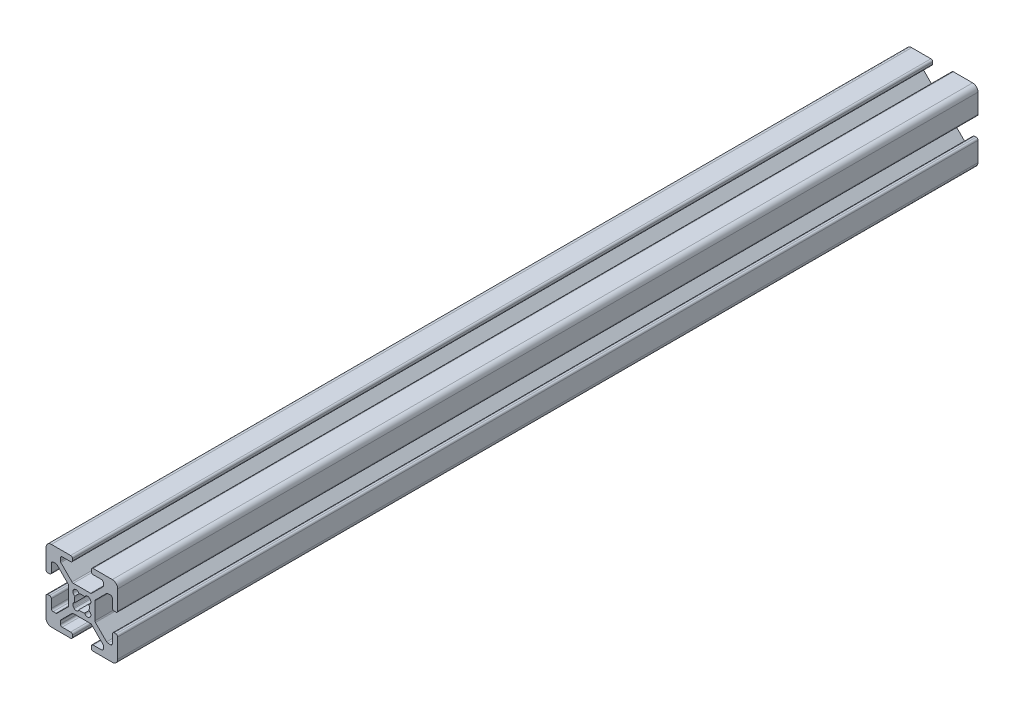
from build123d import *

# Parameters (mm, degrees)
BOSS_EXTRUDE1_DEPTH = 120


with BuildPart() as part:
    # Sketch1 → Boss-Extrude1 (new, symmetric)
    with BuildSketch(Plane.XY):
        with BuildLine():
            Line((10, 3.138), (10, 8.5))
            ThreePointArc((10, 8.5), (9.560660172, 9.560660172), (8.5, 10))
            Line((8.5, 10), (3.138, 10))
            ThreePointArc((3.138, 10), (2.778789755, 9.851210245), (2.63, 9.492))
            Line((2.63, 9.492), (2.63, 9.008))
            ThreePointArc((2.63, 9.008), (2.778789755, 8.648789755), (3.138, 8.5))
            Line((3.138, 8.5), (5.487, 8.5))
            ThreePointArc((5.487, 8.5), (5.846210245, 8.351210245), (5.995, 7.992))
            Line((5.995, 7.992), (5.995, 7.266080661))
            ThreePointArc((5.995, 7.266080661), (5.956330803, 7.071677478), (5.846210245, 6.906870417))
            Line((5.846210245, 6.906870417), (2.743129583, 3.803789755))
            ThreePointArc((2.743129583, 3.803789755), (2.578322522, 3.693669197), (2.383919339, 3.655))
            Line((2.383919339, 3.655), (-2.383919339, 3.655))
            ThreePointArc((-2.383919339, 3.655), (-2.578322522, 3.693669197), (-2.743129583, 3.803789755))
            Line((-2.743129583, 3.803789755), (-5.846210245, 6.906870417))
            ThreePointArc((-5.846210245, 6.906870417), (-5.956330803, 7.071677478), (-5.995, 7.266080661))
            Line((-5.995, 7.266080661), (-5.995, 7.992))
            ThreePointArc((-5.995, 7.992), (-5.846210245, 8.351210245), (-5.487, 8.5))
            Line((-5.487, 8.5), (-3.138, 8.5))
            ThreePointArc((-3.138, 8.5), (-2.778789755, 8.648789755), (-2.63, 9.008))
            Line((-2.63, 9.008), (-2.63, 9.492))
            ThreePointArc((-2.63, 9.492), (-2.778789755, 9.851210245), (-3.138, 10))
            Line((-3.138, 10), (-8.5, 10))
            ThreePointArc((-8.5, 10), (-9.560660172, 9.560660172), (-10, 8.5))
            Line((-10, 8.5), (-10, 3.138))
            ThreePointArc((-10, 3.138), (-9.851210245, 2.778789755), (-9.492, 2.63))
            Line((-9.492, 2.63), (-9.008, 2.63))
            ThreePointArc((-9.008, 2.63), (-8.648789755, 2.778789755), (-8.5, 3.138))
            Line((-8.5, 3.138), (-8.5, 5.487))
            ThreePointArc((-8.5, 5.487), (-8.351210245, 5.846210245), (-7.992, 5.995))
            Line((-7.992, 5.995), (-7.266080661, 5.995))
            ThreePointArc((-7.266080661, 5.995), (-7.071677478, 5.956330803), (-6.906870417, 5.846210245))
            Line((-6.906870417, 5.846210245), (-3.803789755, 2.743129583))
            ThreePointArc((-3.803789755, 2.743129583), (-3.693669197, 2.578322522), (-3.655, 2.383919339))
            Line((-3.655, 2.383919339), (-3.655, -2.383919339))
            ThreePointArc((-3.655, -2.383919339), (-3.693669197, -2.578322522), (-3.803789755, -2.743129583))
            Line((-3.803789755, -2.743129583), (-6.906870417, -5.846210245))
            ThreePointArc((-6.906870417, -5.846210245), (-7.071677478, -5.956330803), (-7.266080661, -5.995))
            Line((-7.266080661, -5.995), (-7.992, -5.995))
            ThreePointArc((-7.992, -5.995), (-8.351210245, -5.846210245), (-8.5, -5.487))
            Line((-8.5, -5.487), (-8.5, -3.138))
            ThreePointArc((-8.5, -3.138), (-8.648789755, -2.778789755), (-9.008, -2.63))
            Line((-9.008, -2.63), (-9.492, -2.63))
            ThreePointArc((-9.492, -2.63), (-9.851210245, -2.778789755), (-10, -3.138))
            Line((-10, -3.138), (-10, -8.5))
            ThreePointArc((-10, -8.5), (-9.560660172, -9.560660172), (-8.5, -10))
            Line((-8.5, -10), (-3.138, -10))
            ThreePointArc((-3.138, -10), (-2.778789755, -9.851210245), (-2.63, -9.492))
            Line((-2.63, -9.492), (-2.63, -9.008))
            ThreePointArc((-2.63, -9.008), (-2.778789755, -8.648789755), (-3.138, -8.5))
            Line((-3.138, -8.5), (-5.487, -8.5))
            ThreePointArc((-5.487, -8.5), (-5.846210245, -8.351210245), (-5.995, -7.992))
            Line((-5.995, -7.992), (-5.995, -7.266080661))
            ThreePointArc((-5.995, -7.266080661), (-5.956330803, -7.071677478), (-5.846210245, -6.906870417))
            Line((-5.846210245, -6.906870417), (-2.743129583, -3.803789755))
            ThreePointArc((-2.743129583, -3.803789755), (-2.578322522, -3.693669197), (-2.383919339, -3.655))
            Line((-2.383919339, -3.655), (2.383919339, -3.655))
            ThreePointArc((2.383919339, -3.655), (2.578322522, -3.693669197), (2.743129583, -3.803789755))
            Line((2.743129583, -3.803789755), (5.846210245, -6.906870417))
            ThreePointArc((5.846210245, -6.906870417), (5.956330803, -7.071677478), (5.995, -7.266080661))
            Line((5.995, -7.266080661), (5.995, -7.992))
            ThreePointArc((5.995, -7.992), (5.846210245, -8.351210245), (5.487, -8.5))
            Line((5.487, -8.5), (3.138, -8.5))
            ThreePointArc((3.138, -8.5), (2.778789755, -8.648789755), (2.63, -9.008))
            Line((2.63, -9.008), (2.63, -9.492))
            ThreePointArc((2.63, -9.492), (2.778789755, -9.851210245), (3.138, -10))
            Line((3.138, -10), (8.5, -10))
            ThreePointArc((8.5, -10), (9.560660172, -9.560660172), (10, -8.5))
            Line((10, -8.5), (10, -3.138))
            ThreePointArc((10, -3.138), (9.851210245, -2.778789755), (9.492, -2.63))
            Line((9.492, -2.63), (9.008, -2.63))
            ThreePointArc((9.008, -2.63), (8.648789755, -2.778789755), (8.5, -3.138))
            Line((8.5, -3.138), (8.5, -5.487))
            ThreePointArc((8.5, -5.487), (8.351210245, -5.846210245), (7.992, -5.995))
            Line((7.992, -5.995), (7.266080661, -5.995))
            ThreePointArc((7.266080661, -5.995), (7.071677478, -5.956330803), (6.906870417, -5.846210245))
            Line((6.906870417, -5.846210245), (3.803789755, -2.743129583))
            ThreePointArc((3.803789755, -2.743129583), (3.693669197, -2.578322522), (3.655, -2.383919339))
            Line((3.655, -2.383919339), (3.655, 2.383919339))
            ThreePointArc((3.655, 2.383919339), (3.693669197, 2.578322522), (3.803789755, 2.743129583))
            Line((3.803789755, 2.743129583), (6.906870417, 5.846210245))
            ThreePointArc((6.906870417, 5.846210245), (7.071677478, 5.956330803), (7.266080661, 5.995))
            Line((7.266080661, 5.995), (7.992, 5.995))
            ThreePointArc((7.992, 5.995), (8.351210245, 5.846210245), (8.5, 5.487))
            Line((8.5, 5.487), (8.5, 3.138))
            ThreePointArc((8.5, 3.138), (8.648789755, 2.778789755), (9.008, 2.63))
            Line((9.008, 2.63), (9.492, 2.63))
            ThreePointArc((9.492, 2.63), (9.851210245, 2.778789755), (10, 3.138))
        make_face()
        with BuildLine():
            Line((-2.124900844, -2.304505966), (-2.304505966, -2.124900844))
            ThreePointArc((-2.304505966, -2.124900844), (-2.505938017, -1.356467811), (-1.935133506, -0.803976718))
            ThreePointArc((-1.935133506, -0.803976718), (-2.0955, 0), (-1.935133506, 0.803976718))
            ThreePointArc((-1.935133506, 0.803976718), (-2.505938017, 1.356467811), (-2.304505966, 2.124900844))
            Line((-2.304505966, 2.124900844), (-2.124900844, 2.304505966))
            ThreePointArc((-2.124900844, 2.304505966), (-1.356467811, 2.505938017), (-0.803976718, 1.935133506))
            ThreePointArc((-0.803976718, 1.935133506), (0, 2.0955), (0.803976718, 1.935133506))
            ThreePointArc((0.803976718, 1.935133506), (1.356467811, 2.505938017), (2.124900844, 2.304505966))
            Line((2.124900844, 2.304505966), (2.304505966, 2.124900844))
            ThreePointArc((2.304505966, 2.124900844), (2.505938017, 1.356467811), (1.935133506, 0.803976718))
            ThreePointArc((1.935133506, 0.803976718), (2.0955, 0), (1.935133506, -0.803976718))
            ThreePointArc((1.935133506, -0.803976718), (2.505938017, -1.356467811), (2.304505966, -2.124900844))
            Line((2.304505966, -2.124900844), (2.124900844, -2.304505966))
            ThreePointArc((2.124900844, -2.304505966), (1.356467811, -2.505938017), (0.803976718, -1.935133506))
            ThreePointArc((0.803976718, -1.935133506), (0, -2.0955), (-0.803976718, -1.935133506))
            ThreePointArc((-0.803976718, -1.935133506), (-1.356467811, -2.505938017), (-2.124900844, -2.304505966))
        make_face(mode=Mode.SUBTRACT)
    extrude(amount=BOSS_EXTRUDE1_DEPTH, both=True)


solid = part.part
